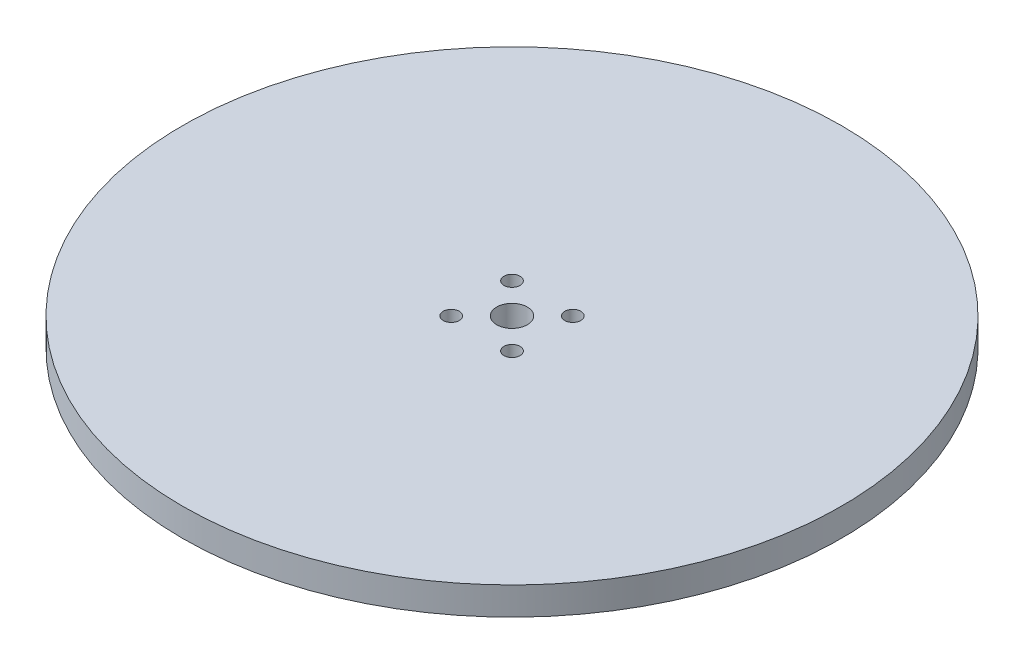
from build123d import *

# Parameters (mm, degrees)
ESQUISSE1_R             = 75
BOSS_EXTRU_1_DEPTH      = 6.35
ESQUISSE2_R             = 3.5
ENL_V_MAT_EXTRU_1_DEPTH = 6.35
SKETCH1_R               = 1.8288
CUT_EXTRUDE1_DEPTH      = 6.35
CIRPATTERN1_COUNT       = 4


with BuildPart() as part:
    # Esquisse1 → Boss.-Extru.1 (new body)
    with BuildSketch(Plane(origin=(0, 0, 0), x_dir=(1, 0, 0), z_dir=(0, 1, 0))):
        with Locations(Location((0, 0, 0), (0, 0, 270))):
            Circle(ESQUISSE1_R)
    extrude(amount=BOSS_EXTRU_1_DEPTH)

    # Esquisse2 → Enlèv. mat.-Extru.1 (cut)
    with BuildSketch(Plane(origin=(0, 6.35, 0), x_dir=(1, 0, 0), z_dir=(0, 1, 0))):
        with Locations(Location((0, 0, 0), (0, 0, 270))):
            Circle(ESQUISSE2_R)
    extrude(amount=-ENL_V_MAT_EXTRU_1_DEPTH, mode=Mode.SUBTRACT)

    # Sketch1 → Cut-Extrude1 (cut)
    with BuildSketch(Plane.XZ):
        with Locations(Location((-6.914797213, 6.914797213, 0), (0, 0, 270))):
            Circle(SKETCH1_R)
    cut_extrude1 = extrude(amount=-CUT_EXTRUDE1_DEPTH, mode=Mode.SUBTRACT)

    # CirPattern1: Cut-Extrude1 ×4 about axis
    cirpattern1_axis = Axis((0, 0, 0), (0, 1, 0))
    for i in range(1, CIRPATTERN1_COUNT):
        add(cut_extrude1.rotate(cirpattern1_axis, i * 360 / CIRPATTERN1_COUNT), mode=Mode.SUBTRACT)


solid = part.part
